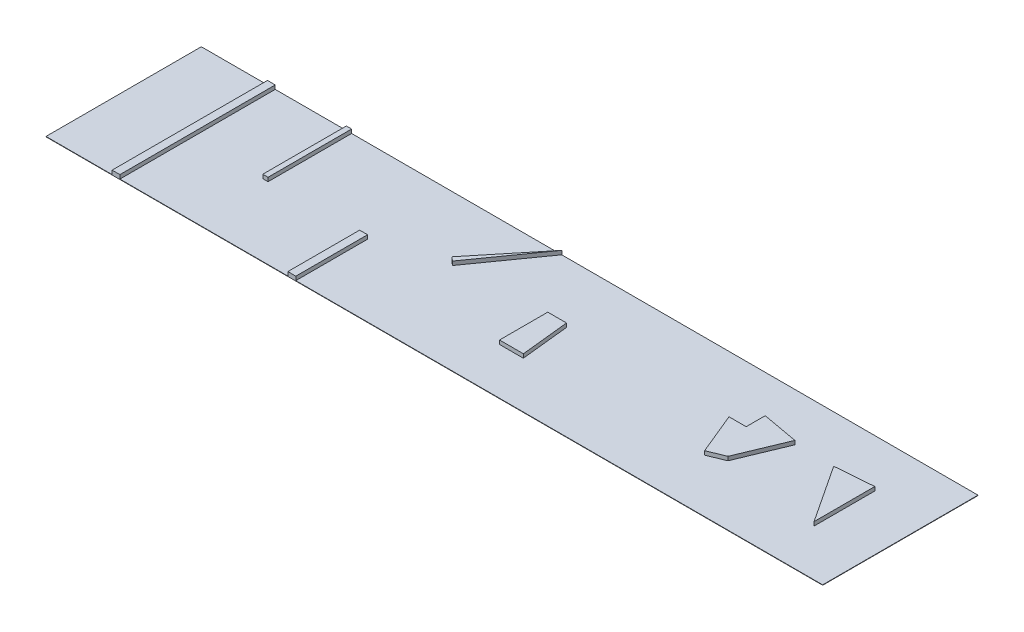
from build123d import *

# Parameters (mm, degrees)
SKETCH1_W           = 10000
SKETCH1_H           = 2000
BOSS_EXTRUDE1_DEPTH = 5
SKETCH2_W           = 100
SKETCH2_H           = 2000
SKETCH2_W_2         = 67.636005508
SKETCH2_H_2         = 1075.746504581
SKETCH2_W_3         = 102.265640327
SKETCH2_H_3         = 924.253495419
BOSS_EXTRUDE2_DEPTH = 50


with BuildPart() as part:
    # Sketch1 → Boss-Extrude1 (new body)
    with BuildSketch(Plane(origin=(0, 0, 0), x_dir=(1, 0, 0), z_dir=(0, 1, 0))):
        with Locations((4877.190876351, -922.388955582)):
            Rectangle(SKETCH1_W, SKETCH1_H)
    extrude(amount=BOSS_EXTRUDE1_DEPTH)

    # Sketch2 → Boss-Extrude2 (add)
    with BuildSketch(Plane(origin=(0, 5, 0), x_dir=(1, 0, 0), z_dir=(0, 1, 0))):
        with Locations((778.754642353, -922.388955582)):
            Rectangle(SKETCH2_W, SKETCH2_H)
        with Locations((1778.185391324, -460.262207873)):
            Rectangle(SKETCH2_W_2, SKETCH2_H_2)
        with Locations((3042.437606271, -1460.262207873)):
            Rectangle(SKETCH2_W_3, SKETCH2_H_3)
        Polygon((4517.984702422, 77.611044418), (3882.476794673, -701.686848024), (3933.609614837, -745.514979593), align=None)
        Polygon((5358.023890825, -701.686848024), (5116.969167196, -701.686848024), (5116.969167196, -1322.585378583), (5423.766088178, -1322.585378583), align=None)
        Polygon((7671.564862573, -701.686848024), (7450.671079466, -701.686848024), (7671.564862573, -1236.828334479), (7884.701735774, -1148.850460529), (8137.613165674, -540.381539223), (7671.564862573, -456.723686309), align=None)
        Polygon((9166.658136654, -540.381539223), (9166.658136654, -1322.585378583), (8675.8952631, -579.205267166), align=None)
    extrude(amount=BOSS_EXTRUDE2_DEPTH)


solid = part.part
